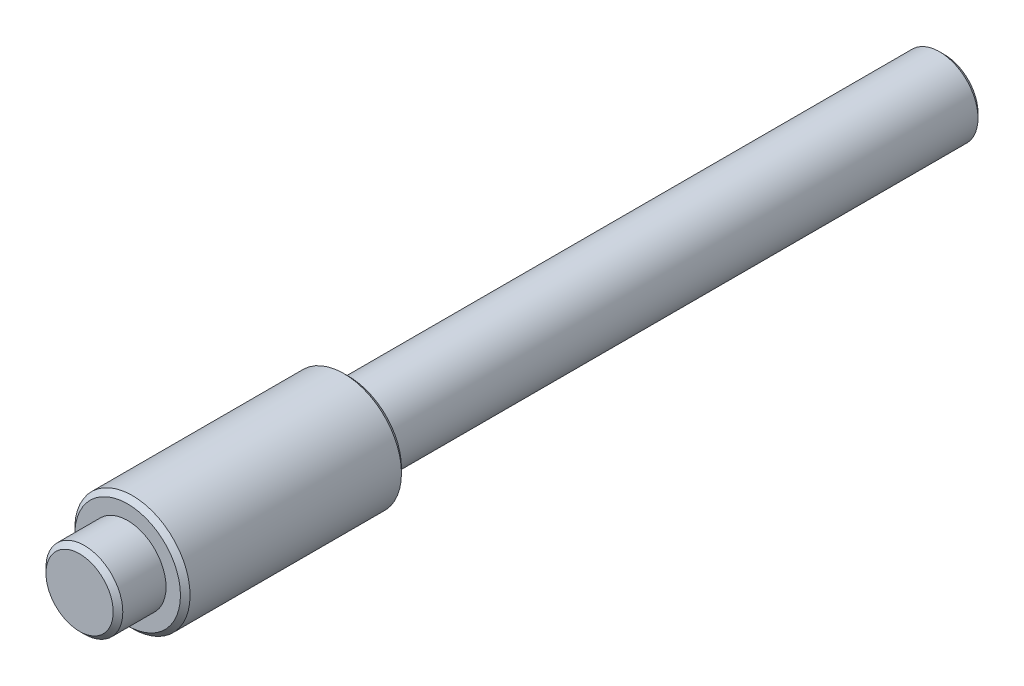
from build123d import *


with BuildPart() as part:
    # Sketch1 → Revolve1 (revolve)
    with BuildSketch(Plane(origin=(0, 0, 0), x_dir=(1, 0, 0), z_dir=(0, 1, 0))):
        Polygon((3.5, 0), (0, 0), (0, -90), (3.5, -90), (4, -89.5), (4, -85), (5.5, -85), (6, -84.5), (6, -62.5), (5.5, -62), (4, -62), (4, -0.5), align=None)
    revolve(axis=Axis((0, 0, 0), (0, 0, 1)))


solid = part.part
